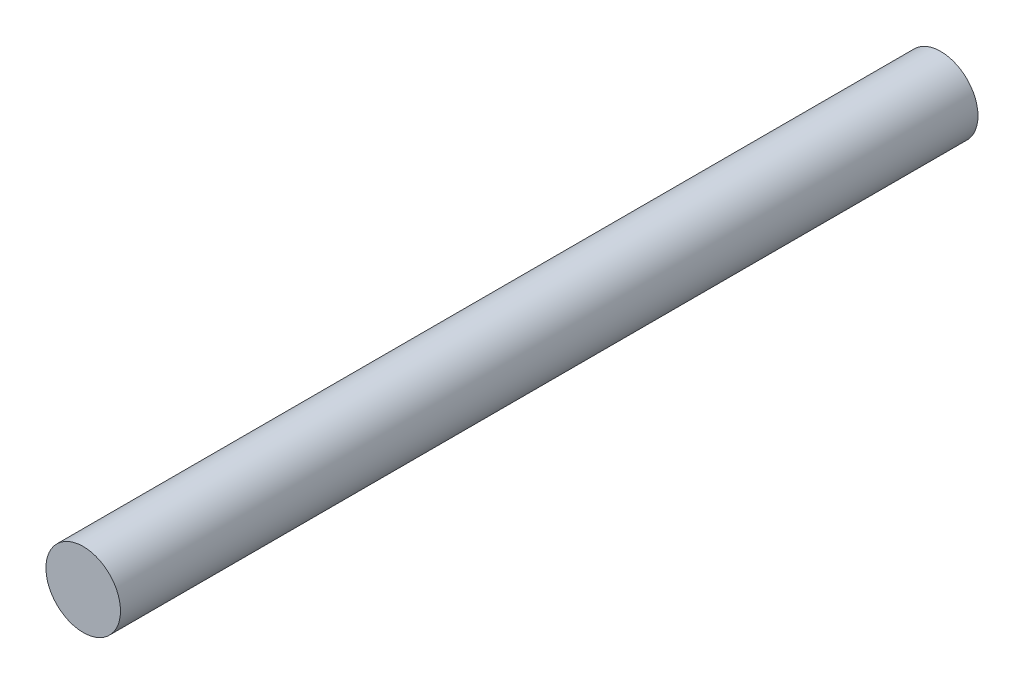
from build123d import *

# Parameters (mm, degrees)
SCHIZZO1_R                   = 2
ESTRUSIONE_ESTRUSIONE1_DEPTH = 46


with BuildPart() as part:
    # Schizzo1 → Estrusione-Estrusione1 (new body)
    with BuildSketch(Plane.XY):
        Circle(SCHIZZO1_R)
    extrude(amount=ESTRUSIONE_ESTRUSIONE1_DEPTH)


solid = part.part
